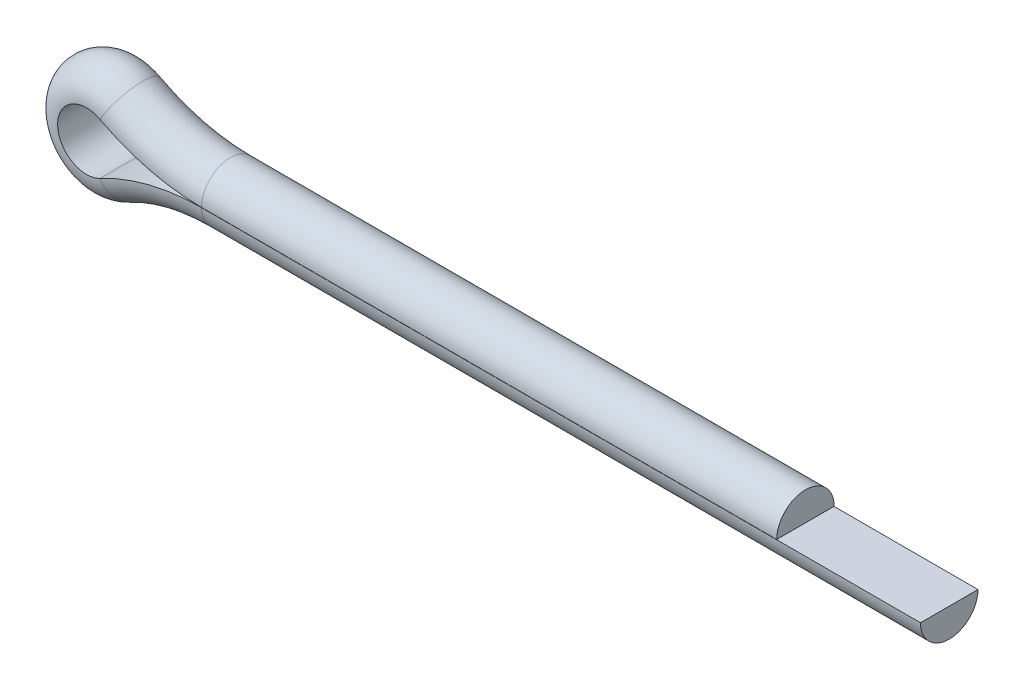
from build123d import *


with BuildPart() as part:
    # Body: sweep along a path in PathSke
    with BuildLine(Plane.XY) as body_path:
        Line((10, 0.5), (0, 0.5))
        ThreePointArc((0, 0.5), (-0.788240781, 0.597036875), (-1.529411765, 0.882352941))
        ThreePointArc((-1.529411765, 0.882352941), (-3, 0), (-1.529411765, -0.882352941))
        ThreePointArc((-1.529411765, -0.882352941), (-0.788240781, -0.597036875), (0, -0.5))
        Line((0, -0.5), (12.5, -0.5))
    # SectionSke → Body (sweep)
    with BuildSketch(Plane(origin=(10, 0, 0), x_dir=(0, 0, -1), z_dir=(1, 0, 0))):
        with BuildLine():
            Line((-0.499996, 0.002), (0.499996, 0.002))
            ThreePointArc((0.499996, 0.002), (0, 0.5), (-0.499996, 0.002))
        make_face()
    sweep(path=body_path.line)


solid = part.part
